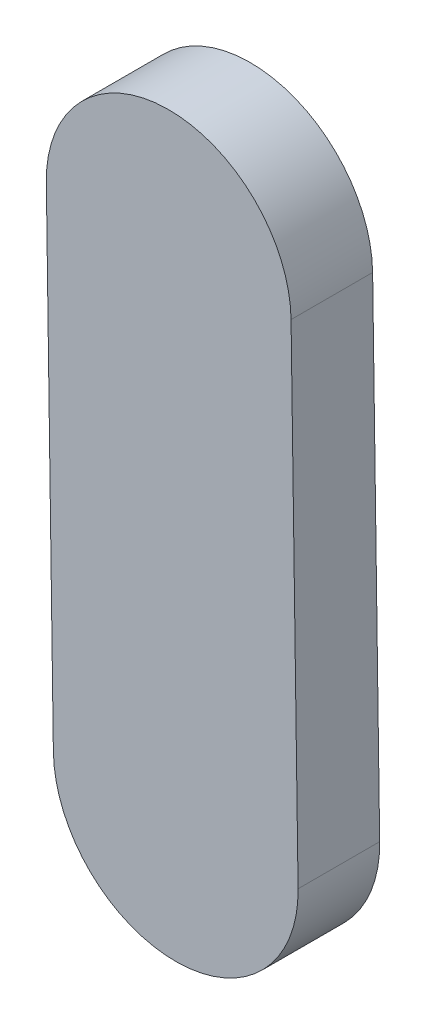
from build123d import *

# Parameters (mm, degrees)
EXTRUDE_1_DEPTH = 1


with BuildPart() as part:
    # 草图1 → 凸台-拉伸1 (new body)
    with BuildSketch(Plane.XY):
        with BuildLine():
            Line((-2.377221091, 6.238455121), (-2.291096689, 0.238455121))
            ThreePointArc((-2.291096689, 0.238455121), (-3.769565589, -1.283075979), (-5.291096689, 0.195392921))
            Line((-5.291096689, 0.195392921), (-5.377221091, 6.195392921))
            ThreePointArc((-5.377221091, 6.195392921), (-3.898752192, 7.716924021), (-2.377221091, 6.238455121))
        make_face()
    extrude(amount=EXTRUDE_1_DEPTH)


solid = part.part
